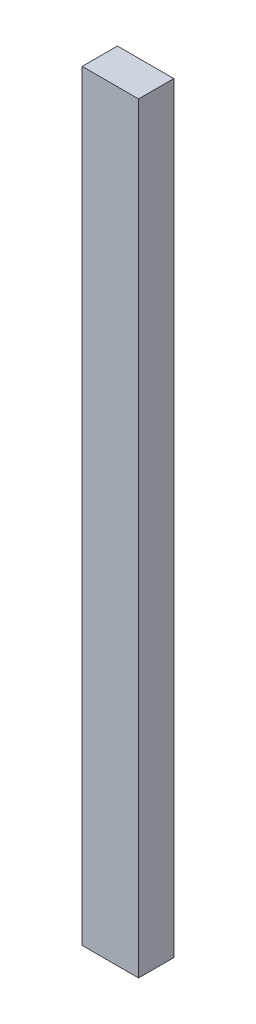
from build123d import *

# Parameters (mm, degrees)
ESQUISSE1_W        = 40
ESQUISSE1_H        = 540
BOSS_EXTRU_1_DEPTH = 25


with BuildPart() as part:
    # Esquisse1 → Boss.-Extru.1 (new body)
    with BuildSketch(Plane.XY):
        with Locations((20, 270)):
            Rectangle(ESQUISSE1_W, ESQUISSE1_H)
    extrude(amount=BOSS_EXTRU_1_DEPTH)


solid = part.part
